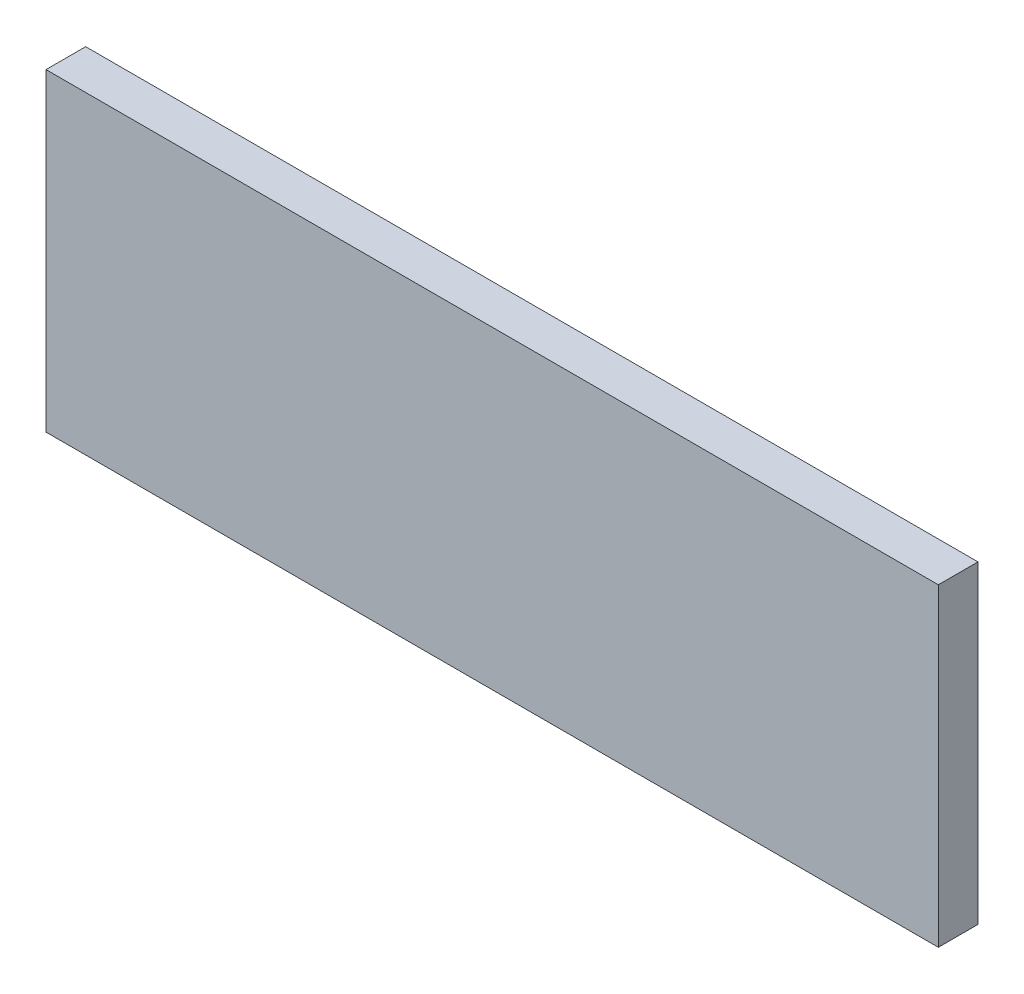
from build123d import *

# Parameters (mm, degrees)
SKETCH1_W           = 270
SKETCH1_H           = 95
BOSS_EXTRUDE1_DEPTH = 6


with BuildPart() as part:
    # Sketch1 → Boss-Extrude1 (new, symmetric)
    with BuildSketch(Plane.XY):
        Rectangle(SKETCH1_W, SKETCH1_H)
    extrude(amount=BOSS_EXTRUDE1_DEPTH, both=True)


solid = part.part
